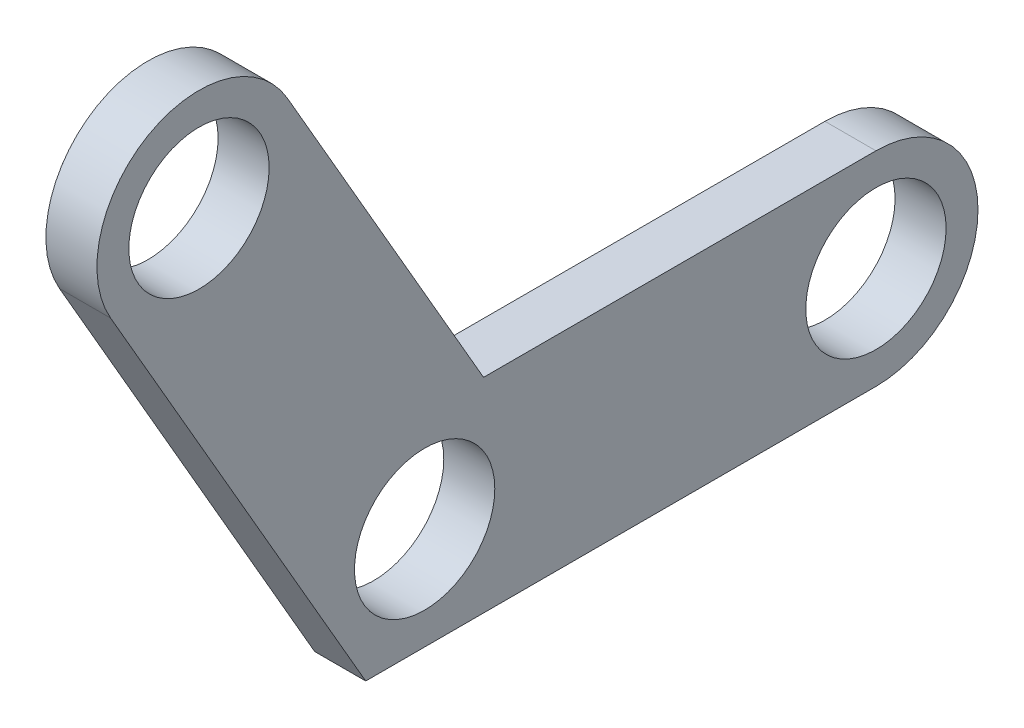
from build123d import *

# Parameters (mm, degrees)
SKETCH1_R           = 2.75
BOSS_EXTRUDE1_DEPTH = 2


with BuildPart() as part:
    # Sketch1 → Boss-Extrude1 (new body)
    with BuildSketch(Plane(origin=(0, 0, 0), x_dir=(0, 0, -1), z_dir=(1, 0, 0))):
        with BuildLine():
            Line((0, 0), (-10, 17.320508076))
            ThreePointArc((-10, 17.320508076), (-8.535898385, 22.784609691), (-3.07179677, 21.320508076))
            Line((-3.07179677, 21.320508076), (4.618802154, 8))
            Line((4.618802154, 8), (20, 8))
            ThreePointArc((20, 8), (24, 4), (20, 0))
            Line((20, 0), (0, 0))
        make_face()
        with Locations((-6.535898385, 19.320508076)):
            Circle(SKETCH1_R, mode=Mode.SUBTRACT)
        with Locations((20, 4)):
            Circle(SKETCH1_R, mode=Mode.SUBTRACT)
        with Locations((2.309401077, 4)):
            Circle(SKETCH1_R, mode=Mode.SUBTRACT)
    extrude(amount=BOSS_EXTRUDE1_DEPTH)


solid = part.part
